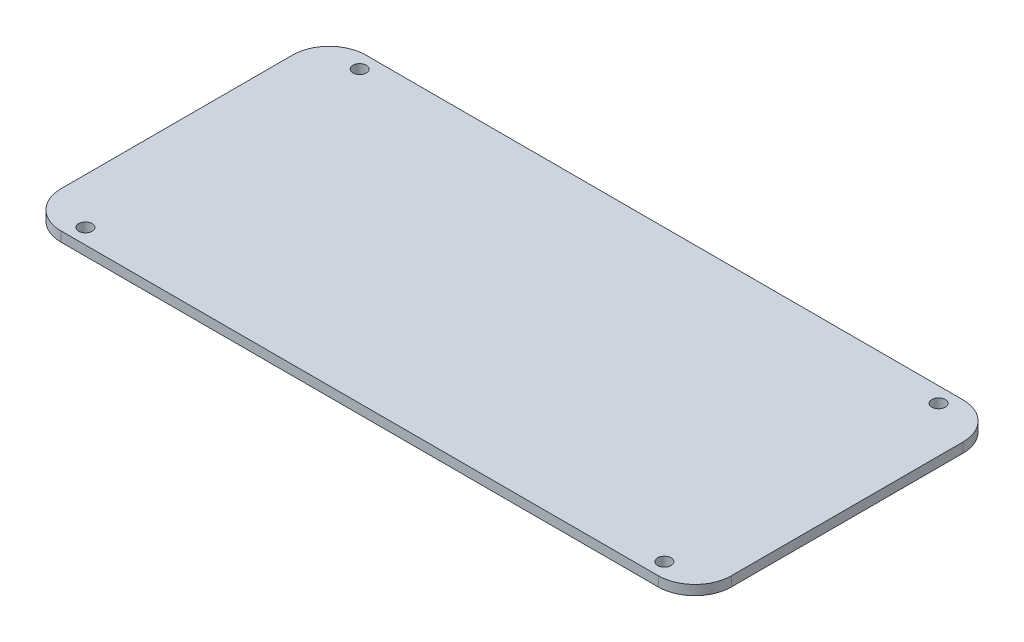
from build123d import *

# Parameters (mm, degrees)
SKIZZE1_R                       = 1.1
AUFSATZ_LINEAR_AUSTRAGEN1_DEPTH = 1.6


with BuildPart() as part:
    # Skizze1 → Aufsatz-Linear austragen1 (new body)
    with BuildSketch(Plane(origin=(0, 0, 0), x_dir=(1, 0, 0), z_dir=(0, 1, 0))):
        with BuildLine():
            Line((-49, 25), (49, 25))
            ThreePointArc((49, 25), (53.242640687, 23.242640687), (55, 19))
            Line((55, 19), (55, -19))
            ThreePointArc((55, -19), (53.242640687, -23.242640687), (49, -25))
            Line((49, -25), (-49, -25))
            ThreePointArc((-49, -25), (-53.242640687, -23.242640687), (-55, -19))
            Line((-55, -19), (-55, 19))
            ThreePointArc((-55, 19), (-53.242640687, 23.242640687), (-49, 25))
        make_face()
        with Locations(Location((47.5, 22.5, 0), (0, 0, 270))):
            Circle(SKIZZE1_R, mode=Mode.SUBTRACT)
        with Locations(Location((-47.5, 22.5, 0), (0, 0, 270))):
            Circle(SKIZZE1_R, mode=Mode.SUBTRACT)
        with Locations(Location((47.5, -22.5, 0), (0, 0, 270))):
            Circle(SKIZZE1_R, mode=Mode.SUBTRACT)
        with Locations(Location((-47.5, -22.5, 0), (0, 0, 270))):
            Circle(SKIZZE1_R, mode=Mode.SUBTRACT)
    extrude(amount=AUFSATZ_LINEAR_AUSTRAGEN1_DEPTH)


solid = part.part
